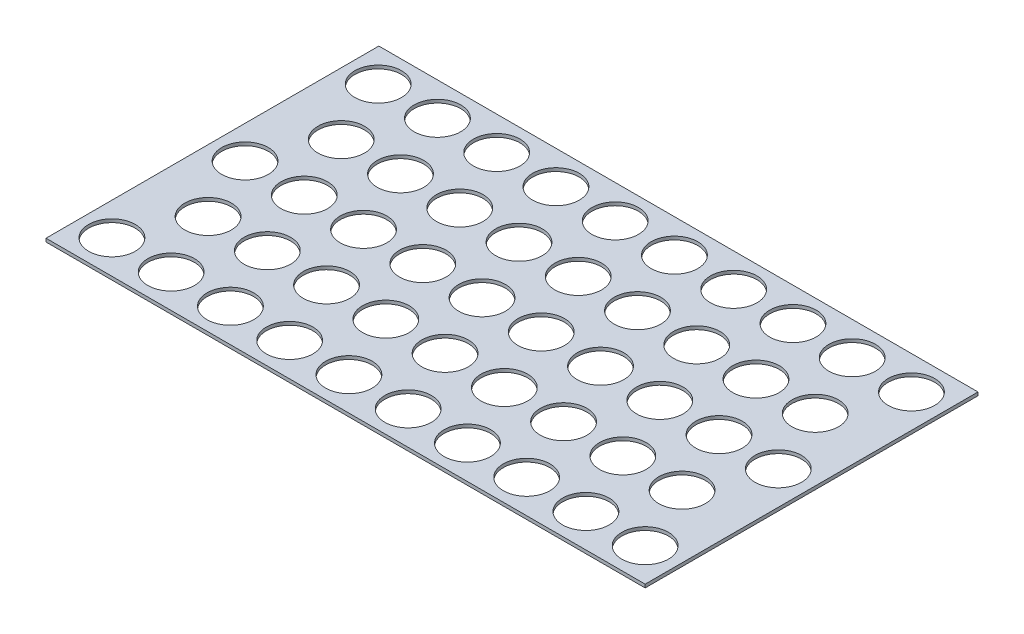
from build123d import *

# Parameters (mm, degrees)
SKETCH1_W               = 228.6
SKETCH1_H               = 127
BOSS_EXTRUDE1_DEPTH     = 1.27
CUT_EXTRUDE1_DEPTH      = 176.706526426
CUT_EXTRUDE1_DEPTH_BACK = 176.706526426
SKETCH2_R               = 8.89


with BuildPart() as part:
    # Sketch1 → Boss-Extrude1 (new body)
    with BuildSketch(Plane(origin=(0, 0, 0), x_dir=(1, 0, 0), z_dir=(0, 1, 0))):
        with Locations((26.414806677, -41.716508736)):
            Rectangle(SKETCH1_W, SKETCH1_H)
    extrude(amount=BOSS_EXTRUDE1_DEPTH)

    # Sketch2 → Cut-Extrude1 (cut, two sides: drawn at the far end of the back side and taken through both)
    with BuildSketch(Plane(origin=(0, 1.27, 0), x_dir=(1, 0, 0), z_dir=(0, 1, 0)).offset(-CUT_EXTRUDE1_DEPTH_BACK)):
        with Locations(Location((128.014806677, 9.083491264, 0), (0, 0, 270))):
            Circle(SKETCH2_R)
        with Locations(Location((105.408806677, 9.083491264, 0), (0, 0, 270))):
            Circle(SKETCH2_R)
        with Locations(Location((82.802806677, 9.083491264, 0), (0, 0, 270))):
            Circle(SKETCH2_R)
        with Locations(Location((60.196806677, 9.083491264, 0), (0, 0, 270))):
            Circle(SKETCH2_R)
        with Locations(Location((37.590806677, 9.083491264, 0), (0, 0, 270))):
            Circle(SKETCH2_R)
        with Locations(Location((14.984806677, 9.083491264, 0), (0, 0, 270))):
            Circle(SKETCH2_R)
        with Locations(Location((-7.621193323, 9.083491264, 0), (0, 0, 270))):
            Circle(SKETCH2_R)
        with Locations(Location((-30.227193323, 9.083491264, 0), (0, 0, 270))):
            Circle(SKETCH2_R)
        with Locations(Location((-52.833193323, 9.083491264, 0), (0, 0, 270))):
            Circle(SKETCH2_R)
        with Locations(Location((-75.439193323, 9.083491264, 0), (0, 0, 270))):
            Circle(SKETCH2_R)
        with Locations(Location((128.014806677, -41.716508736, 0), (0, 0, 270))):
            Circle(SKETCH2_R)
        with Locations(Location((128.014806677, -92.516508736, 0), (0, 0, 270))):
            Circle(SKETCH2_R)
        with Locations(Location((105.408806677, -41.716508736, 0), (0, 0, 270))):
            Circle(SKETCH2_R)
        with Locations(Location((105.408806677, -92.516508736, 0), (0, 0, 270))):
            Circle(SKETCH2_R)
        with Locations(Location((82.802806677, -41.716508736, 0), (0, 0, 270))):
            Circle(SKETCH2_R)
        with Locations(Location((82.802806677, -92.516508736, 0), (0, 0, 270))):
            Circle(SKETCH2_R)
        with Locations(Location((60.196806677, -41.716508736, 0), (0, 0, 270))):
            Circle(SKETCH2_R)
        with Locations(Location((60.196806677, -92.516508736, 0), (0, 0, 270))):
            Circle(SKETCH2_R)
        with Locations(Location((37.590806677, -41.716508736, 0), (0, 0, 270))):
            Circle(SKETCH2_R)
        with Locations(Location((37.590806677, -92.516508736, 0), (0, 0, 270))):
            Circle(SKETCH2_R)
        with Locations(Location((14.984806677, -41.716508736, 0), (0, 0, 270))):
            Circle(SKETCH2_R)
        with Locations(Location((14.984806677, -92.516508736, 0), (0, 0, 270))):
            Circle(SKETCH2_R)
        with Locations(Location((-7.621193323, -41.716508736, 0), (0, 0, 270))):
            Circle(SKETCH2_R)
        with Locations(Location((-7.621193323, -92.516508736, 0), (0, 0, 270))):
            Circle(SKETCH2_R)
        with Locations(Location((-30.227193323, -41.716508736, 0), (0, 0, 270))):
            Circle(SKETCH2_R)
        with Locations(Location((-30.227193323, -92.516508736, 0), (0, 0, 270))):
            Circle(SKETCH2_R)
        with Locations(Location((-52.833193323, -41.716508736, 0), (0, 0, 270))):
            Circle(SKETCH2_R)
        with Locations(Location((-52.833193323, -92.516508736, 0), (0, 0, 270))):
            Circle(SKETCH2_R)
        with Locations(Location((-75.439193323, -41.716508736, 0), (0, 0, 270))):
            Circle(SKETCH2_R)
        with Locations(Location((-75.439193323, -92.516508736, 0), (0, 0, 270))):
            Circle(SKETCH2_R)
        with Locations(Location((116.711806677, -16.316508736, 0), (0, 0, 270))):
            Circle(SKETCH2_R)
        with Locations(Location((116.711806677, -67.116508736, 0), (0, 0, 270))):
            Circle(SKETCH2_R)
        with Locations(Location((94.105806677, -16.316508736, 0), (0, 0, 270))):
            Circle(SKETCH2_R)
        with Locations(Location((94.105806677, -67.116508736, 0), (0, 0, 270))):
            Circle(SKETCH2_R)
        with Locations(Location((71.499806677, -16.316508736, 0), (0, 0, 270))):
            Circle(SKETCH2_R)
        with Locations(Location((71.499806677, -67.116508736, 0), (0, 0, 270))):
            Circle(SKETCH2_R)
        with Locations(Location((48.893806677, -16.316508736, 0), (0, 0, 270))):
            Circle(SKETCH2_R)
        with Locations(Location((48.893806677, -67.116508736, 0), (0, 0, 270))):
            Circle(SKETCH2_R)
        with Locations(Location((26.287806677, -16.316508736, 0), (0, 0, 270))):
            Circle(SKETCH2_R)
        with Locations(Location((26.287806677, -67.116508736, 0), (0, 0, 270))):
            Circle(SKETCH2_R)
        with Locations(Location((3.681806677, -16.316508736, 0), (0, 0, 270))):
            Circle(SKETCH2_R)
        with Locations(Location((3.681806677, -67.116508736, 0), (0, 0, 270))):
            Circle(SKETCH2_R)
        with Locations(Location((-18.924193323, -16.316508736, 0), (0, 0, 270))):
            Circle(SKETCH2_R)
        with Locations(Location((-18.924193323, -67.116508736, 0), (0, 0, 270))):
            Circle(SKETCH2_R)
        with Locations(Location((-41.530193323, -16.316508736, 0), (0, 0, 270))):
            Circle(SKETCH2_R)
        with Locations(Location((-41.530193323, -67.116508736, 0), (0, 0, 270))):
            Circle(SKETCH2_R)
        with Locations(Location((-64.136193323, -16.316508736, 0), (0, 0, 270))):
            Circle(SKETCH2_R)
        with Locations(Location((-64.136193323, -67.116508736, 0), (0, 0, 270))):
            Circle(SKETCH2_R)
    extrude(amount=CUT_EXTRUDE1_DEPTH + CUT_EXTRUDE1_DEPTH_BACK, mode=Mode.SUBTRACT)


solid = part.part
